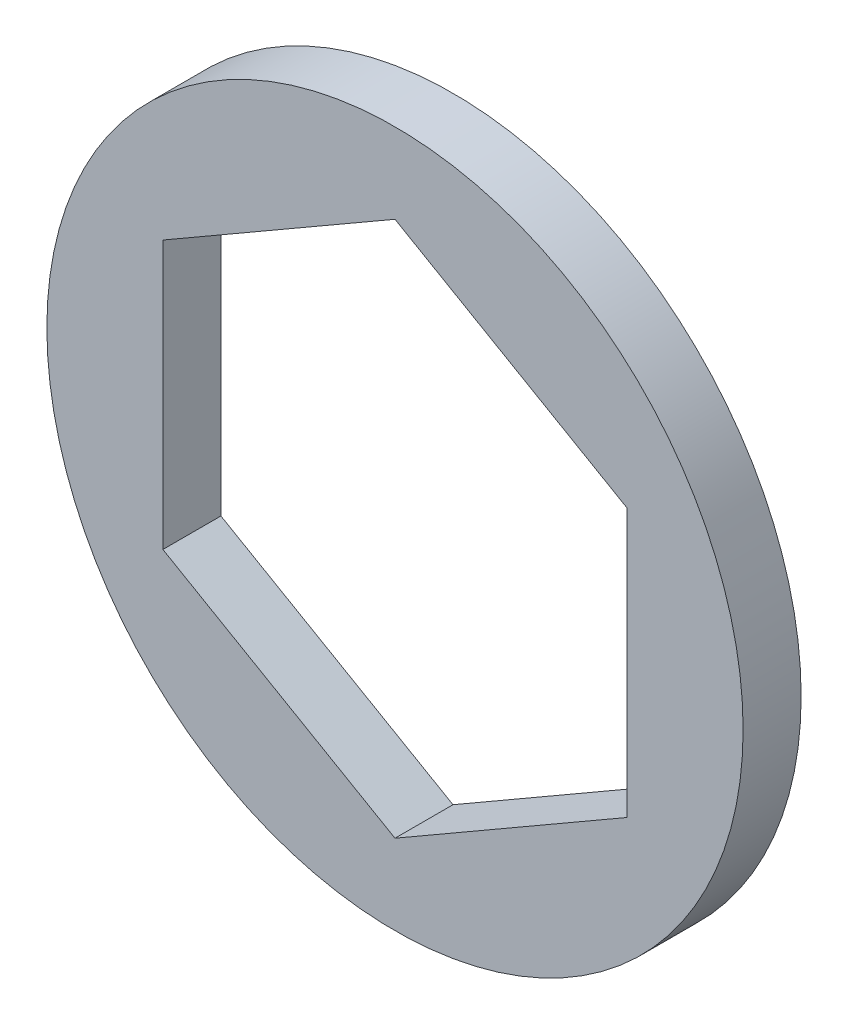
from build123d import *

# Parameters (mm, degrees)
SKETCH1_R           = 9.525
BOSS_EXTRUDE2_DEPTH = 1.5875


with BuildPart() as part:
    # Sketch1 → Boss-Extrude2 (new body)
    with BuildSketch(Plane.XY):
        Circle(SKETCH1_R)
        Polygon((0, 7.332348419), (-6.35, 3.666174209), (-6.35, -3.666174209), (0, -7.332348419), (6.35, -3.666174209), (6.35, 3.666174209), align=None, mode=Mode.SUBTRACT)
    extrude(amount=BOSS_EXTRUDE2_DEPTH)


solid = part.part
